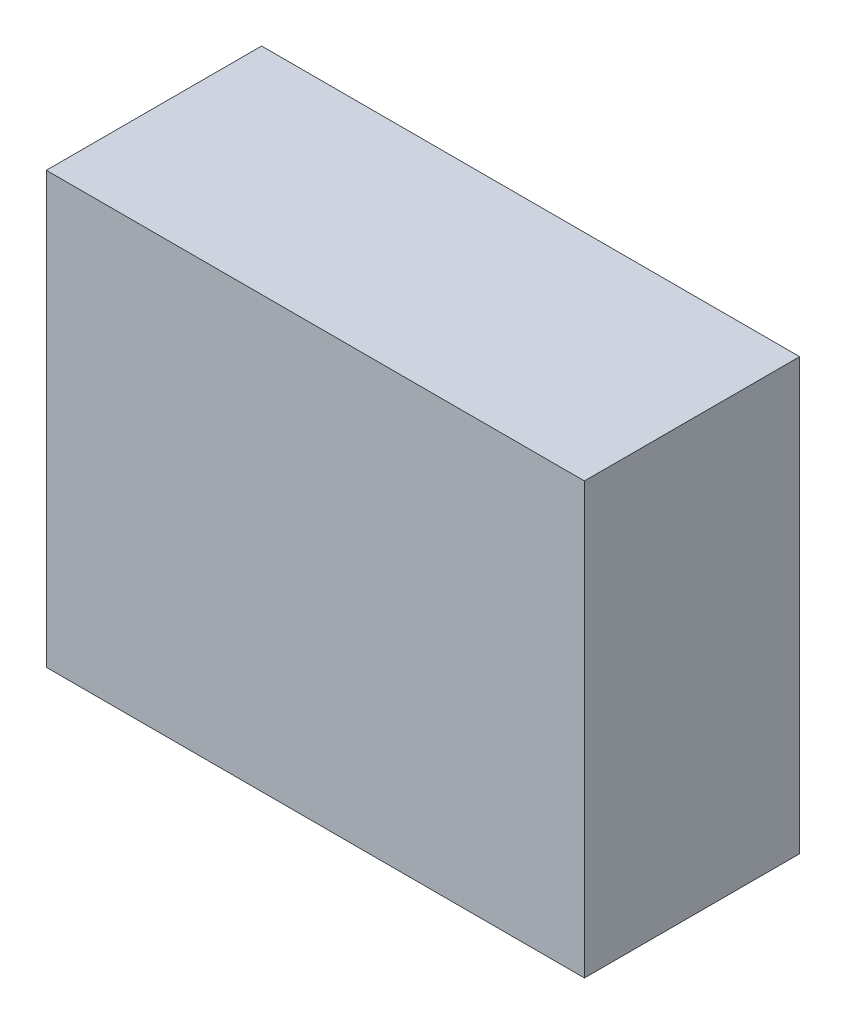
from build123d import *

# Parameters (mm, degrees)
SKETCH2_W              = 30
SKETCH2_H              = 24
REFERENCE_COUPON_DEPTH = 12


with BuildPart() as part:
    # Sketch2 → Reference_coupon (new body)
    with BuildSketch(Plane.XY):
        Rectangle(SKETCH2_W, SKETCH2_H)
    extrude(amount=REFERENCE_COUPON_DEPTH)


solid = part.part
